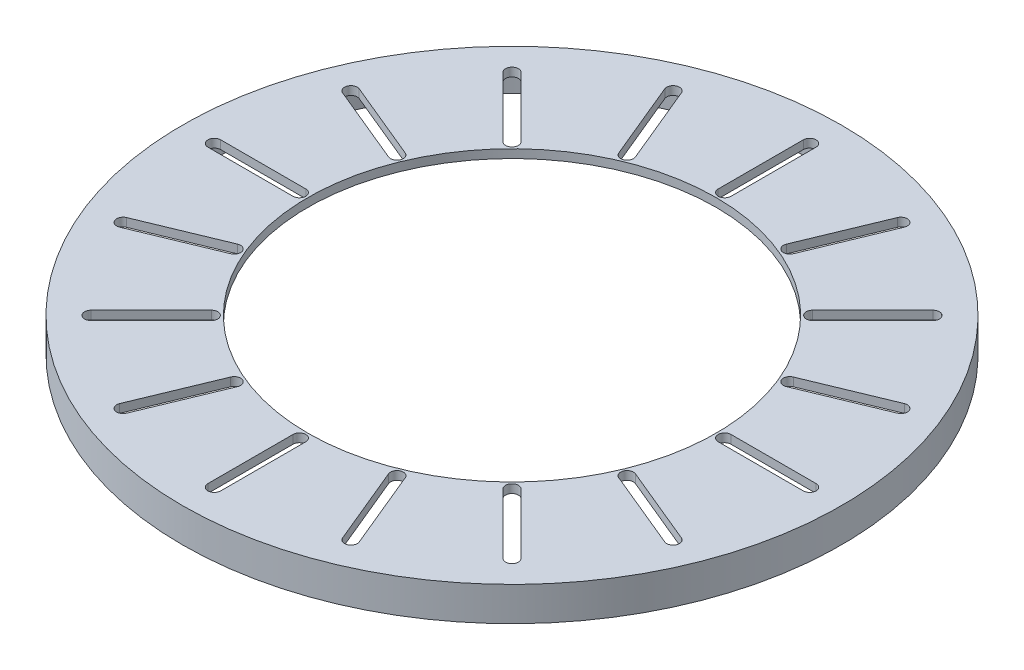
from build123d import *

# Parameters (mm, degrees)
SKETCH1_R           = 38.75
SKETCH1_R_2         = 37.6
BOSS_EXTRUDE1_DEPTH = 3
SKETCH2_R           = 38.75
SKETCH2_R_2         = 24
BOSS_EXTRUDE2_DEPTH = 1
CUT_EXTRUDE3_DEPTH  = 1


with BuildPart() as part:
    # Sketch1 → Boss-Extrude1 (new body)
    with BuildSketch(Plane(origin=(0, 0, 0), x_dir=(1, 0, 0), z_dir=(0, 1, 0))):
        with Locations(Location((0, 0, 0), (0, 0, 270))):
            Circle(SKETCH1_R)
        with Locations(Location((0, 0, 0), (0, 0, 270))):
            Circle(SKETCH1_R_2, mode=Mode.SUBTRACT)
    extrude(amount=BOSS_EXTRUDE1_DEPTH)

    # Sketch2 → Boss-Extrude2 (add)
    with BuildSketch(Plane(origin=(0, 3, 0), x_dir=(1, 0, 0), z_dir=(0, 1, 0))):
        with Locations(Location((0, 0, 0), (0, 0, 270))):
            Circle(SKETCH2_R)
        with Locations(Location((0, 0, 0), (0, 0, 270))):
            Circle(SKETCH2_R_2, mode=Mode.SUBTRACT)
    extrude(amount=BOSS_EXTRUDE2_DEPTH)

    # Sketch4 → Cut-Extrude3 (cut)
    with BuildSketch(Plane(origin=(0, 4, 0), x_dir=(1, 0, 0), z_dir=(0, 1, 0))):
        with BuildLine():
            Line((-0.75, 25), (-0.75, 35))
            ThreePointArc((-0.75, 35), (0, 35.75), (0.75, 35))
            Line((0.75, 35), (0.75, 25))
            ThreePointArc((0.75, 25), (0, 24.25), (-0.75, 25))
        make_face()
        with BuildLine():
            Line((8.87417616, 23.384000887), (12.701010483, 32.622796212))
            ThreePointArc((12.701010483, 32.622796212), (13.680932707, 33.028693287), (14.086829782, 32.048771064))
            Line((14.086829782, 32.048771064), (10.259995459, 22.809975739))
            ThreePointArc((10.259995459, 22.809975739), (9.280073235, 22.404078663), (8.87417616, 23.384000887))
        make_face()
        with BuildLine():
            Line((17.147339444, 18.207999616), (24.218407256, 25.279067427))
            ThreePointArc((24.218407256, 25.279067427), (25.279067427, 25.279067427), (25.279067427, 24.218407256))
            Line((25.279067427, 24.218407256), (18.207999616, 17.147339444))
            ThreePointArc((18.207999616, 17.147339444), (17.147339444, 17.147339444), (17.147339444, 18.207999616))
        make_face()
        with BuildLine():
            Line((22.809975739, 10.259995459), (32.048771064, 14.086829782))
            ThreePointArc((32.048771064, 14.086829782), (33.028693287, 13.680932707), (32.622796212, 12.701010483))
            Line((32.622796212, 12.701010483), (23.384000887, 8.87417616))
            ThreePointArc((23.384000887, 8.87417616), (22.404078663, 9.280073235), (22.809975739, 10.259995459))
        make_face()
        with BuildLine():
            Line((25, 0.75), (35, 0.75))
            ThreePointArc((35, 0.75), (35.75, 0), (35, -0.75))
            Line((35, -0.75), (25, -0.75))
            ThreePointArc((25, -0.75), (24.25, 0), (25, 0.75))
        make_face()
        with BuildLine():
            Line((23.384000887, -8.87417616), (32.622796212, -12.701010483))
            ThreePointArc((32.622796212, -12.701010483), (33.028693287, -13.680932707), (32.048771064, -14.086829782))
            Line((32.048771064, -14.086829782), (22.809975739, -10.259995459))
            ThreePointArc((22.809975739, -10.259995459), (22.404078663, -9.280073235), (23.384000887, -8.87417616))
        make_face()
        with BuildLine():
            Line((18.207999616, -17.147339444), (25.279067427, -24.218407256))
            ThreePointArc((25.279067427, -24.218407256), (25.279067427, -25.279067427), (24.218407256, -25.279067427))
            Line((24.218407256, -25.279067427), (17.147339444, -18.207999616))
            ThreePointArc((17.147339444, -18.207999616), (17.147339444, -17.147339444), (18.207999616, -17.147339444))
        make_face()
        with BuildLine():
            Line((10.259995459, -22.809975739), (14.086829782, -32.048771064))
            ThreePointArc((14.086829782, -32.048771064), (13.680932707, -33.028693287), (12.701010483, -32.622796212))
            Line((12.701010483, -32.622796212), (8.87417616, -23.384000887))
            ThreePointArc((8.87417616, -23.384000887), (9.280073235, -22.404078663), (10.259995459, -22.809975739))
        make_face()
        with BuildLine():
            Line((0.75, -25), (0.75, -35))
            ThreePointArc((0.75, -35), (0, -35.75), (-0.75, -35))
            Line((-0.75, -35), (-0.75, -25))
            ThreePointArc((-0.75, -25), (0, -24.25), (0.75, -25))
        make_face()
        with BuildLine():
            Line((-8.87417616, -23.384000887), (-12.701010483, -32.622796212))
            ThreePointArc((-12.701010483, -32.622796212), (-13.680932707, -33.028693287), (-14.086829782, -32.048771064))
            Line((-14.086829782, -32.048771064), (-10.259995459, -22.809975739))
            ThreePointArc((-10.259995459, -22.809975739), (-9.280073235, -22.404078663), (-8.87417616, -23.384000887))
        make_face()
        with BuildLine():
            Line((-17.147339444, -18.207999616), (-24.218407256, -25.279067427))
            ThreePointArc((-24.218407256, -25.279067427), (-25.279067427, -25.279067427), (-25.279067427, -24.218407256))
            Line((-25.279067427, -24.218407256), (-18.207999616, -17.147339444))
            ThreePointArc((-18.207999616, -17.147339444), (-17.147339444, -17.147339444), (-17.147339444, -18.207999616))
        make_face()
        with BuildLine():
            Line((-22.809975739, -10.259995459), (-32.048771064, -14.086829782))
            ThreePointArc((-32.048771064, -14.086829782), (-33.028693287, -13.680932707), (-32.622796212, -12.701010483))
            Line((-32.622796212, -12.701010483), (-23.384000887, -8.87417616))
            ThreePointArc((-23.384000887, -8.87417616), (-22.404078663, -9.280073235), (-22.809975739, -10.259995459))
        make_face()
        with BuildLine():
            Line((-25, -0.75), (-35, -0.75))
            ThreePointArc((-35, -0.75), (-35.75, 0), (-35, 0.75))
            Line((-35, 0.75), (-25, 0.75))
            ThreePointArc((-25, 0.75), (-24.25, 0), (-25, -0.75))
        make_face()
        with BuildLine():
            Line((-23.384000887, 8.87417616), (-32.622796212, 12.701010483))
            ThreePointArc((-32.622796212, 12.701010483), (-33.028693287, 13.680932707), (-32.048771064, 14.086829782))
            Line((-32.048771064, 14.086829782), (-22.809975739, 10.259995459))
            ThreePointArc((-22.809975739, 10.259995459), (-22.404078663, 9.280073235), (-23.384000887, 8.87417616))
        make_face()
        with BuildLine():
            Line((-18.207999616, 17.147339444), (-25.279067427, 24.218407256))
            ThreePointArc((-25.279067427, 24.218407256), (-25.279067427, 25.279067427), (-24.218407256, 25.279067427))
            Line((-24.218407256, 25.279067427), (-17.147339444, 18.207999616))
            ThreePointArc((-17.147339444, 18.207999616), (-17.147339444, 17.147339444), (-18.207999616, 17.147339444))
        make_face()
        with BuildLine():
            Line((-10.259995459, 22.809975739), (-14.086829782, 32.048771064))
            ThreePointArc((-14.086829782, 32.048771064), (-13.680932707, 33.028693287), (-12.701010483, 32.622796212))
            Line((-12.701010483, 32.622796212), (-8.87417616, 23.384000887))
            ThreePointArc((-8.87417616, 23.384000887), (-9.280073235, 22.404078663), (-10.259995459, 22.809975739))
        make_face()
    extrude(amount=-CUT_EXTRUDE3_DEPTH, mode=Mode.SUBTRACT)


solid = part.part
